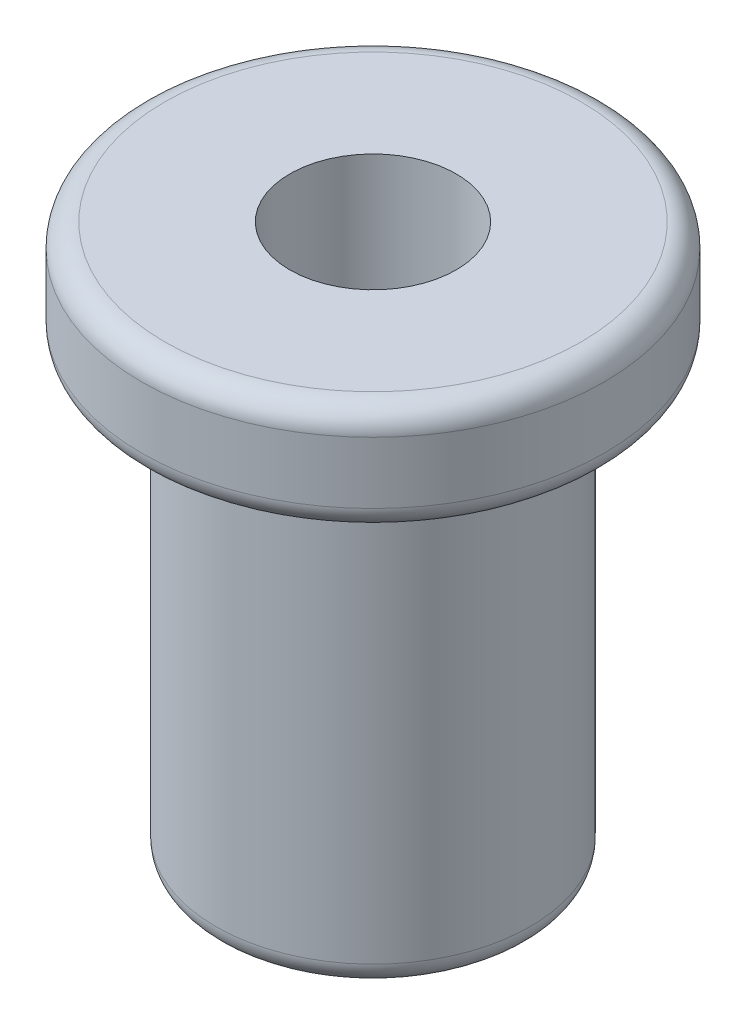
from build123d import *

# Parameters (mm, degrees)
FILLET1_R = 0.75


with BuildPart() as part:
    # Sketch1 → Revolve1 (revolve)
    with BuildSketch(Plane(origin=(0, 0, 0), x_dir=(0, 0, -1), z_dir=(1, 0, 0)), mode=Mode.PRIVATE) as revolve1_sk:
        Polygon((2.7, 0), (2.7, -15), (2, -15), (2, -18), (5.1, -18), (5.1, -3.5), (7.5, -3.5), (7.5, 0), align=None)
    revolve(revolve1_sk.sketch.rotate(Axis((0, 0, 0), (0, -1, 0)), 180), axis=Axis((0, 0, 0), (0, -1, 0)))

    # Fillet1
    fillet1_edges = [part.edges().sort_by_distance(p)[0] for p in [
        (0, 0, -7.5),
        (0, -3.5, -7.5),
        (0, -18, -5.1),
    ]]
    fillet(fillet1_edges, radius=FILLET1_R)


solid = part.part
